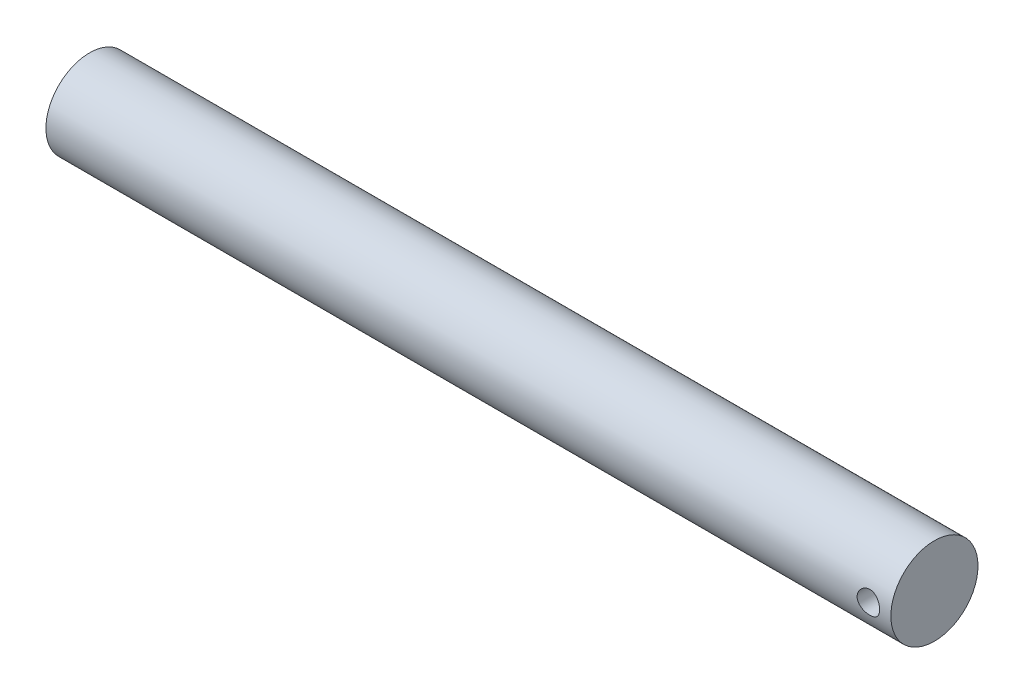
from build123d import *

# Parameters (mm, degrees)
SKETCH1_R               = 4.85
BOSS_EXTRUDE1_DEPTH     = 103.5535633
CUT_EXTRUDE1_DEPTH      = 104.780467681
CUT_EXTRUDE1_DEPTH_BACK = 104.780467681
SKETCH2_R               = 1.25
CUT_EXTRUDE2_DEPTH      = 104.78046779
CUT_EXTRUDE2_DEPTH_BACK = 104.78046779
SKETCH3_W               = 42.028968594
SKETCH3_H               = 71.494930271
SCALE1_SCALE            = 1.5


with BuildPart() as part:
    # Sketch1 → Boss-Extrude1 (new body)
    with BuildSketch(Plane(origin=(0, 0, 0), x_dir=(0, 0, -1), z_dir=(1, 0, 0))):
        Circle(SKETCH1_R)
    extrude(amount=BOSS_EXTRUDE1_DEPTH)

    # Sketch2 → Cut-Extrude1 (cut, two sides: drawn at the far end of the back side and taken through both)
    with BuildSketch(Plane.XY.offset(-CUT_EXTRUDE1_DEPTH_BACK)):
        with Locations((101.0535633, 0)):
            Circle(SKETCH2_R)
    extrude(amount=CUT_EXTRUDE1_DEPTH + CUT_EXTRUDE1_DEPTH_BACK, mode=Mode.SUBTRACT)

    # Sketch3 → Cut-Extrude2 (cut, two sides: drawn at the far end of the back side and taken through both)
    with BuildSketch(Plane(origin=(0, 0, 0), x_dir=(1, 0, 0), z_dir=(0, 1, 0)).offset(-CUT_EXTRUDE2_DEPTH_BACK)):
        with Locations((-11.495089548, 16.503222723)):
            Rectangle(SKETCH3_W, SKETCH3_H)
    extrude(amount=CUT_EXTRUDE2_DEPTH + CUT_EXTRUDE2_DEPTH_BACK, mode=Mode.SUBTRACT)


with BuildPart() as part_1:
    # Scale1: scaled about (56.231945049, 6e-09, 2.83e-07)
    add(part.part.scale(SCALE1_SCALE).moved(Location((-28.115972524, -3e-09, -1.41e-07))))


solid = part_1.part
